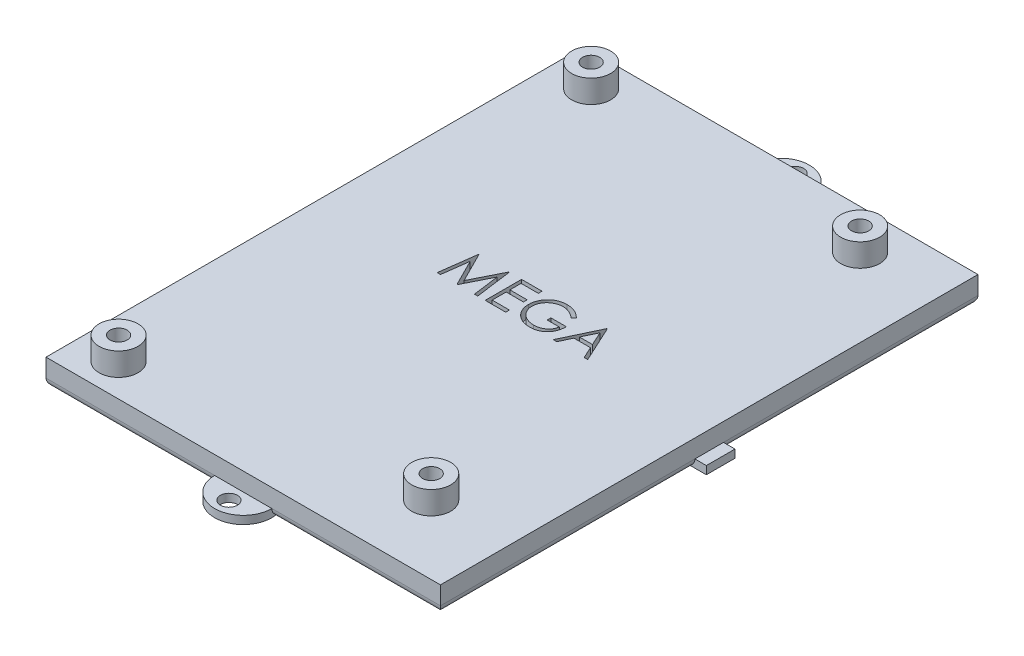
from build123d import *

# Parameters (mm, degrees)
SKETCH1_W           = 68.9
SKETCH1_H           = 93.9
BOSS_EXTRUDE1_DEPTH = 4.575
SKETCH2_R           = 3.405
SKETCH2_R_2         = 1.5
BOSS_EXTRUDE2_DEPTH = 4
CUT_EXTRUDE1_START  = -3.575
SKETCH3_R           = 1.5
CUT_EXTRUDE1_DEPTH  = 3.575
SKETCH4_R           = 1.5
BOSS_EXTRUDE3_DEPTH = 1.4
CUT_EXTRUDE2_DEPTH  = 2
SKETCH6_W           = 5
SKETCH6_H           = 1.4
BOSS_EXTRUDE4_DEPTH = 2
FILLET1_R           = 1.4


with BuildPart() as part:
    # Sketch1 → Boss-Extrude1 (new body)
    with BuildSketch(Plane(origin=(0, 0, 0), x_dir=(1, 0, 0), z_dir=(0, 1, 0))):
        Rectangle(SKETCH1_W, SKETCH1_H)
    extrude(amount=BOSS_EXTRUDE1_DEPTH)

    # Sketch2 → Boss-Extrude2 (add)
    # profile 1 of 4: a face of its own
    with BuildSketch(Plane(origin=(0, 4.575, 0), x_dir=(1, 0, 0), z_dir=(0, 1, 0))):
        with Locations(Location((-27.45, 41.275, 0), (0, 0, 270))):
            Circle(SKETCH2_R)
        with Locations(Location((-27.45, 41.275, 0), (0, 0, 270))):
            Circle(SKETCH2_R_2, mode=Mode.SUBTRACT)
    # profile 2 of 4: a face of its own
    with BuildSketch(Plane(origin=(0, 4.575, 0), x_dir=(1, 0, 0), z_dir=(0, 1, 0))):
        with Locations(Location((-27.45, -41.275, 0), (0, 0, 270))):
            Circle(SKETCH2_R)
        with Locations(Location((-27.45, -41.275, 0), (0, 0, 270))):
            Circle(SKETCH2_R_2, mode=Mode.SUBTRACT)
    # profile 3 of 4: a face of its own
    with BuildSketch(Plane(origin=(0, 4.575, 0), x_dir=(1, 0, 0), z_dir=(0, 1, 0))):
        with Locations(Location((20.81, -34.925, 0), (0, 0, 270))):
            Circle(SKETCH2_R)
        with Locations(Location((20.81, -34.925, 0), (0, 0, 270))):
            Circle(SKETCH2_R_2, mode=Mode.SUBTRACT)
    # profile 4 of 4: a face of its own
    with BuildSketch(Plane(origin=(0, 4.575, 0), x_dir=(1, 0, 0), z_dir=(0, 1, 0))):
        with Locations(Location((20.81, 40.005, 0), (0, 0, 270))):
            Circle(SKETCH2_R)
        with Locations(Location((20.81, 40.005, 0), (0, 0, 270))):
            Circle(SKETCH2_R_2, mode=Mode.SUBTRACT)
    extrude(amount=BOSS_EXTRUDE2_DEPTH)

    # Sketch3 → Cut-Extrude1 (cut)
    with BuildSketch(Plane(origin=(0, 4.575, 0), x_dir=(1, 0, 0), z_dir=(0, 1, 0)).offset(CUT_EXTRUDE1_START)):
        with Locations(Location((-27.45, 41.275, 0), (0, 0, 270))):
            Circle(SKETCH3_R)
        with Locations(Location((20.81, 40.005, 0), (0, 0, 270))):
            Circle(SKETCH3_R)
        with Locations(Location((20.81, -34.925, 0), (0, 0, 270))):
            Circle(SKETCH3_R)
        with Locations(Location((-27.45, -41.275, 0), (0, 0, 270))):
            Circle(SKETCH3_R)
    extrude(amount=CUT_EXTRUDE1_DEPTH, mode=Mode.SUBTRACT)

    # Sketch4 → Boss-Extrude3 (add)
    with BuildSketch(Plane(origin=(0, 0, 0), x_dir=(1, 0, 0), z_dir=(0, 1, 0))):
        with BuildLine():
            Line((-5, -46.95), (5, -46.95))
            ThreePointArc((5, -46.95), (0, -51.95), (-5, -46.95))
        make_face()
        with Locations(Location((0, -49.45, 0), (0, 0, 270))):
            Circle(SKETCH4_R, mode=Mode.SUBTRACT)
    boss_extrude3 = extrude(amount=BOSS_EXTRUDE3_DEPTH)

    # Mirror1: Boss-Extrude3 across plane
    add(boss_extrude3.mirror(Plane.XY))

    # Sketch5 → Cut-Extrude2 (cut)
    # profile 1 of 4: a face of its own
    with BuildSketch(Plane(origin=(0, 4.575, 0), x_dir=(1, 0, 0), z_dir=(0, 1, 0))):
        Polygon((-13.066346154, 0), (-12.22807492, 6.35), (-12.146664663, 6.35), (-9.525, 1.13974359), (-6.909695513, 6.35), (-6.827013221, 6.35), (-5.983653846, 0), (-6.556069712, 0), (-7.164102564, 4.569150641), (-9.456310096, 0), (-9.584785657, 0), (-11.885897436, 4.579326923), (-12.492658253, 0), align=None)
    # profile 2 of 4: a face of its own
    with BuildSketch(Plane(origin=(0, 4.575, 0), x_dir=(1, 0, 0), z_dir=(0, 1, 0))):
        Polygon((-4.681089744, 6.35), (-1.099038462, 6.35), (-1.099038462, 5.698717949), (-4.111217949, 5.698717949), (-4.111217949, 3.744871795), (-1.099038462, 3.744871795), (-1.099038462, 3.093589744), (-4.111217949, 3.093589744), (-4.111217949, 0.651282051), (-1.099038462, 0.651282051), (-1.099038462, 0), (-4.681089744, 0), align=None)
    # profile 3 of 4: a face of its own
    with BuildSketch(Plane(origin=(0, 4.575, 0), x_dir=(1, 0, 0), z_dir=(0, 1, 0))):
        with BuildLine():
            Line((5.983653846, 5.266225962), (5.495192308, 4.803205128))
            add(Edge.make_bspline(
                [(5.495192308, 4.803205128), (5.406802325, 4.886355408), (5.232130069, 5.050673202), (4.947359343, 5.263871722), (4.650245322, 5.44650879), (4.342338363, 5.595110104), (4.031263558, 5.713678684), (3.721149921, 5.798094024), (3.415178434, 5.851928485), (3.211675052, 5.858366241), (3.111398237, 5.861538462)],
                knots=[0, 0, 0, 0, 1.08915593, 2.152340314, 3.188132944, 4.216796309, 5.218260357, 6.173443236, 7.099959455, 8, 8, 8, 8], degree=3))
            add(Edge.make_bspline(
                [(3.111398237, 5.861538462), (3.049867282, 5.860788062), (2.926964954, 5.85928921), (2.744407998, 5.840158991), (2.563765671, 5.812645595), (2.385378977, 5.772836759), (2.208901071, 5.72238318), (2.034945738, 5.659272411), (1.86318848, 5.585693611), (1.695247162, 5.500671694), (1.532432248, 5.407272544), (1.378659132, 5.303770192), (1.23294768, 5.193481959), (1.098036623, 5.07364661), (0.973149927, 4.94534964), (0.855315024, 4.810977642), (0.748676215, 4.66685946), (0.652353673, 4.515646681), (0.566426165, 4.359995138), (0.490573323, 4.201402999), (0.426897177, 4.040396292), (0.376515451, 3.87677298), (0.334948979, 3.71179891), (0.305707034, 3.544331774), (0.289221124, 3.374192259), (0.286369466, 3.26026009), (0.284935897, 3.202984776)],
                knots=[0, 0, 0, 0, 1.02818874, 2.053710826, 3.065248034, 4.081641283, 5.106893873, 6.131558223, 7.173050175, 8.228653731, 9.27666206, 10.308777013, 11.325269123, 12.329503258, 13.32196095, 14.316845687, 15.314881793, 16.315733098, 17.311955233, 18.285320748, 19.252783886, 20.203351036, 21.145449891, 22.095197417, 23.042428769, 24, 24, 24, 24], degree=3))
            add(Edge.make_bspline(
                [(0.284935897, 3.202984776), (0.286306986, 3.144436293), (0.28904542, 3.027499204), (0.306572, 2.852975672), (0.33909895, 2.681044157), (0.382583222, 2.511139687), (0.436976988, 2.34297128), (0.504781682, 2.177268012), (0.585092129, 2.014036016), (0.678049873, 1.854746054), (0.779987699, 1.699582855), (0.894184432, 1.553424865), (1.015488633, 1.414325798), (1.148319566, 1.285374055), (1.288417878, 1.163120415), (1.439969293, 1.05093311), (1.599993757, 0.946651191), (1.768735413, 0.851588935), (1.944363318, 0.766664877), (2.124443428, 0.691147237), (2.309551036, 0.628954725), (2.498713344, 0.578267022), (2.691704851, 0.53671934), (2.889505179, 0.509990411), (3.09065995, 0.490594189), (3.226257183, 0.489176017), (3.294571314, 0.488461538)],
                knots=[0, 0, 0, 0, 0.93586088, 1.869166235, 2.799637598, 3.729985548, 4.670839027, 5.622275134, 6.589130586, 7.576015415, 8.568469353, 9.55398029, 10.53834874, 11.515998671, 12.510579167, 13.508179873, 14.527009472, 15.561807829, 16.601455013, 17.643573243, 18.680854198, 19.719860599, 20.772568776, 21.833555941, 22.908541556, 24, 24, 24, 24], degree=3))
            add(Edge.make_bspline(
                [(3.294571314, 0.488461538), (3.376900601, 0.490182527), (3.538567532, 0.493561967), (3.776214364, 0.519869635), (4.004457078, 0.560957389), (4.222654333, 0.621129802), (4.431059556, 0.697880755), (4.630436749, 0.790400956), (4.819216187, 0.902239078), (4.997965374, 1.028465951), (5.162624839, 1.169100004), (5.311131607, 1.320854944), (5.441116994, 1.482994151), (5.554518377, 1.654562652), (5.64833265, 1.836980562), (5.725336007, 2.029353925), (5.784360693, 2.231769268), (5.808590433, 2.371635515), (5.820833333, 2.442307692)],
                knots=[0, 0, 0, 0, 1.13008108, 2.219097802, 3.278683437, 4.311054135, 5.322181354, 6.324827112, 7.324222904, 8.330512327, 9.32562643, 10.293043162, 11.24128371, 12.174520618, 13.111833804, 14.052305215, 15.015860969, 16, 16, 16, 16], degree=3))
            Line((5.820833333, 2.442307692), (3.704166667, 2.442307692))
            Line((3.704166667, 2.442307692), (3.704166667, 3.093589744))
            Line((3.704166667, 3.093589744), (6.390705128, 3.093589744))
            add(Edge.make_bspline(
                [(6.390705128, 3.093589744), (6.387610232, 2.972200442), (6.381552961, 2.734619652), (6.339064357, 2.388145018), (6.270454399, 2.060899232), (6.176727833, 1.752537659), (6.055396967, 1.463497283), (5.907763951, 1.193484641), (5.73146596, 0.944244091), (5.53278273, 0.713740899), (5.309807093, 0.508129328), (5.068564025, 0.327415698), (4.808654954, 0.175192381), (4.530325732, 0.051348037), (4.234487517, -0.045306211), (3.920455742, -0.113834643), (3.588656267, -0.154891862), (3.361259724, -0.160137651), (3.244961939, -0.162820513)],
                knots=[0, 0, 0, 0, 1.140356446, 2.231883559, 3.274166699, 4.278491846, 5.25512956, 6.21435461, 7.1637429, 8.11826594, 9.068280886, 10.0076534, 10.945064095, 11.891975133, 12.864533718, 13.863980011, 14.907571808, 16, 16, 16, 16], degree=3))
            add(Edge.make_bspline(
                [(3.244961939, -0.162820513), (3.173279265, -0.161787964), (3.031897929, -0.159751446), (2.823090102, -0.145278258), (2.620039562, -0.122997784), (2.422775888, -0.089351632), (2.230573468, -0.048140759), (2.044392221, 0.004630859), (1.863522917, 0.0657155), (1.687686, 0.135194793), (1.518477466, 0.215697656), (1.355143642, 0.30515943), (1.196781671, 0.403118813), (1.044470272, 0.511269919), (0.897415844, 0.628803811), (0.756566596, 0.755956064), (0.621134018, 0.892337953), (0.536297177, 0.989182727), (0.493549679, 1.037980769)],
                knots=[0, 0, 0, 0, 1.107784379, 2.184907829, 3.233506516, 4.263428166, 5.276301166, 6.270063455, 7.25232949, 8.225834625, 9.190232166, 10.146266622, 11.1027726, 12.066435141, 13.031522626, 14.010570082, 14.99756817, 16, 16, 16, 16], degree=3))
            add(Edge.make_bspline(
                [(0.493549679, 1.037980769), (0.431526632, 1.115397525), (0.308510054, 1.268945999), (0.150162542, 1.514963041), (0.015177139, 1.769692131), (-0.094347338, 2.033842385), (-0.179869295, 2.307166728), (-0.241203496, 2.589315899), (-0.277139578, 2.880653229), (-0.28231671, 3.077803066), (-0.284935897, 3.177544071)],
                knots=[0, 0, 0, 0, 1.023165419, 2.029347347, 3.013907458, 3.994755782, 4.975994455, 5.96558838, 6.970761222, 8, 8, 8, 8], degree=3))
            add(Edge.make_bspline(
                [(-0.284935897, 3.177544071), (-0.283970265, 3.252231415), (-0.282051274, 3.400656872), (-0.258782123, 3.62101513), (-0.225396693, 3.837460672), (-0.176325609, 4.049816567), (-0.114465243, 4.25822464), (-0.037261061, 4.462781661), (0.052627536, 4.663608342), (0.157104079, 4.85932236), (0.273371598, 5.047326651), (0.39955557, 5.22686438), (0.537447816, 5.39466597), (0.684796481, 5.552856531), (0.843359591, 5.699448725), (1.011651689, 5.835799755), (1.189802468, 5.96209252), (1.378372394, 6.076337792), (1.574546908, 6.17896036), (1.777855767, 6.268929359), (1.988236912, 6.343284803), (2.204114192, 6.406374374), (2.427121658, 6.453028986), (2.655640989, 6.486863139), (2.890863335, 6.510014512), (3.049860131, 6.511876434), (3.130478766, 6.512820513)],
                knots=[0, 0, 0, 0, 1.008945113, 2.00506715, 2.99143336, 3.967273523, 4.948097931, 5.927297278, 6.919902385, 7.919676788, 8.923139349, 9.905703106, 10.883022732, 11.856032218, 12.825136022, 13.798837087, 14.781400844, 15.773989409, 16.776158564, 17.77167057, 18.775803737, 19.789618931, 20.80898985, 21.851988756, 22.910860228, 24, 24, 24, 24], degree=3))
            add(Edge.make_bspline(
                [(3.130478766, 6.512820513), (3.196225294, 6.511769149), (3.326592932, 6.509684419), (3.520586761, 6.495234272), (3.711582088, 6.472330944), (3.899862109, 6.441076632), (4.084785659, 6.398506793), (4.266879539, 6.347564762), (4.446407712, 6.288252456), (4.622807536, 6.217515549), (4.797265106, 6.137226829), (4.970750445, 6.046851049), (5.142670792, 5.944842826), (5.313324286, 5.830899269), (5.483787057, 5.706977353), (5.651362908, 5.56953283), (5.820096821, 5.423985831), (5.928594399, 5.319333868), (5.983653846, 5.266225962)],
                knots=[0, 0, 0, 0, 0.985871117, 1.954866573, 2.915460327, 3.869826059, 4.81536089, 5.759505086, 6.70452669, 7.649098992, 8.607881297, 9.583363685, 10.581137262, 11.603961102, 12.659522466, 13.73993555, 14.853081303, 16, 16, 16, 16], degree=3))
        make_face()
    # profile 4 of 4: a face of its own
    with BuildSketch(Plane(origin=(0, 4.575, 0), x_dir=(1, 0, 0), z_dir=(0, 1, 0))):
        Polygon((10.298397436, 6.35), (13.229166667, 0), (12.609685497, 0), (11.670923478, 2.03525641), (8.792307692, 2.03525641), (7.826832933, 0), (7.204807692, 0), (10.216987179, 6.35), align=None)
        Polygon((10.251332131, 5.112309696), (9.10141226, 2.686538462), (11.370723157, 2.686538462), align=None, mode=Mode.SUBTRACT)
    extrude(amount=-CUT_EXTRUDE2_DEPTH, mode=Mode.SUBTRACT)

    # Sketch6 → Boss-Extrude4 (add)
    with BuildSketch(Plane.ZY.offset(34.45)):
        with Locations((0, 0.7)):
            Rectangle(SKETCH6_W, SKETCH6_H)
    boss_extrude4 = extrude(amount=BOSS_EXTRUDE4_DEPTH)

    # Mirror2: Boss-Extrude4 across plane
    add(boss_extrude4.mirror(Plane(origin=(0, 0, 0), x_dir=(0, 0, 1), z_dir=(1, 0, 0))))

    # Fillet1
    fillet1_edges = [part.edges().sort_by_distance(p)[0] for p in [
        (-34.45, 0, 24.725),
        (34.45, 0, -24.725),
        (19.725, 0, -46.95),
        (34.45, 0, 24.725),
        (19.725, 0, 46.95),
        (-19.725, 0, 46.95),
        (-34.45, 0, -24.725),
        (-19.725, 0, -46.95),
    ]]
    fillet(fillet1_edges, radius=FILLET1_R)


solid = part.part
